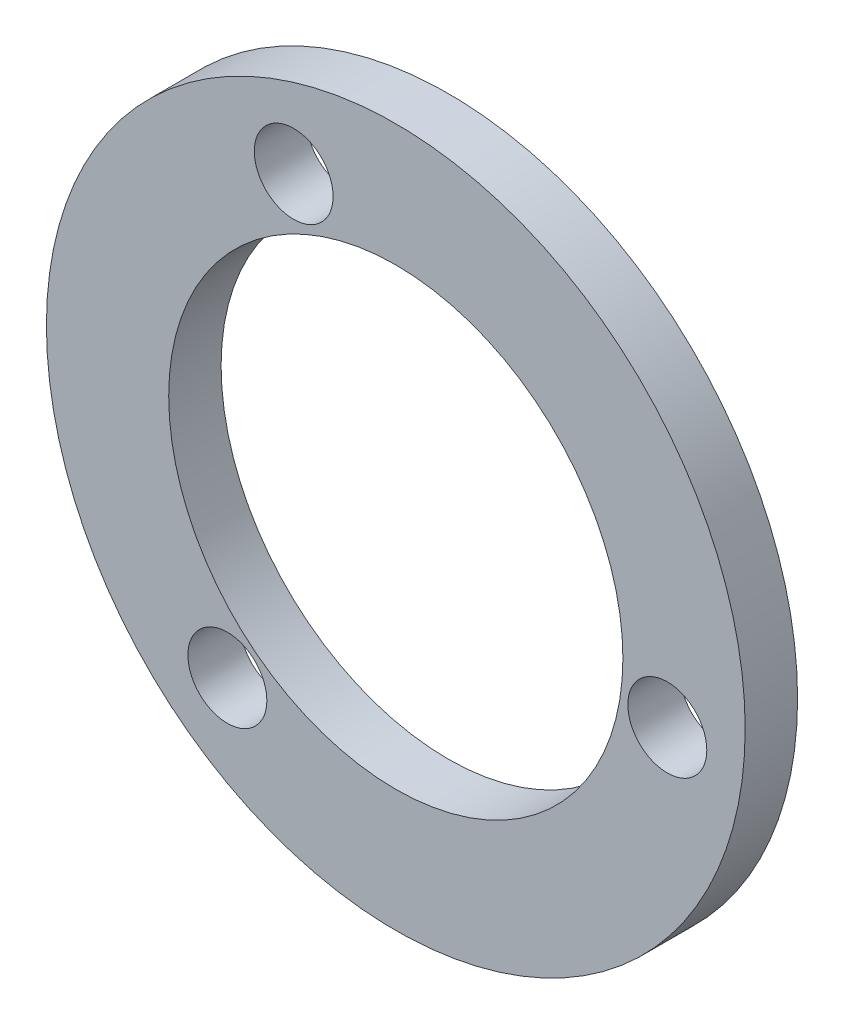
from build123d import *

# Parameters (mm, degrees)
SKETCH1_R           = 20
SKETCH1_R_2         = 13
SKETCH1_R_3         = 2.255208331
SKETCH1_R_4         = 2.259811145
SKETCH1_R_5         = 2.260191801
BOSS_EXTRUDE1_DEPTH = 3


with BuildPart() as part:
    # Sketch1 → Boss-Extrude1 (new body)
    with BuildSketch(Plane.XY):
        with Locations((197.599478725, 433.875501537)):
            Circle(SKETCH1_R)
        with Locations((197.599478725, 433.875501537)):
            Circle(SKETCH1_R_2, mode=Mode.SUBTRACT)
        with Locations((191.754521776, 448.464909961)):
            Circle(SKETCH1_R_3, mode=Mode.SUBTRACT)
        with Locations((213.14171821, 431.718291046)):
            Circle(SKETCH1_R_4, mode=Mode.SUBTRACT)
        with Locations((187.958721116, 421.587983347)):
            Circle(SKETCH1_R_5, mode=Mode.SUBTRACT)
    extrude(amount=BOSS_EXTRUDE1_DEPTH)


solid = part.part
